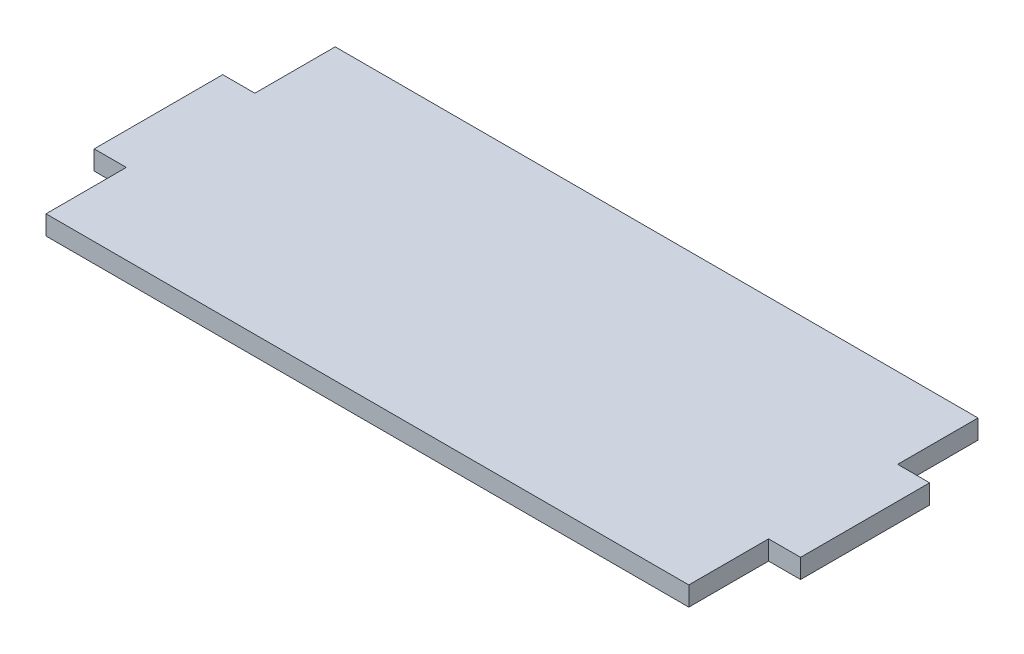
from build123d import *

# Parameters (mm, degrees)
SKETCH_1_W      = 100.023288524
SKETCH_1_H      = 45
SKETCH_1_W_2    = 5
SKETCH_1_H_2    = 20.085340428
SKETCH_1_W_3    = 5.299442369
SKETCH_1_H_3    = 20
EXTRUDE_1_DEPTH = 3


with BuildPart() as part:
    # 草图1 → 凸台-拉伸1 (new body)
    with BuildSketch(Plane(origin=(0, 0, 0), x_dir=(1, 0, 0), z_dir=(0, 1, 0))):
        with Locations((0.011644262, 0)):
            Rectangle(SKETCH_1_W, SKETCH_1_H)
        with Locations((52.5, -0.042670214)):
            Rectangle(SKETCH_1_W_2, SKETCH_1_H_2)
        with Locations((-52.350278816, 0)):
            Rectangle(SKETCH_1_W_3, SKETCH_1_H_3)
    extrude(amount=EXTRUDE_1_DEPTH)


solid = part.part
